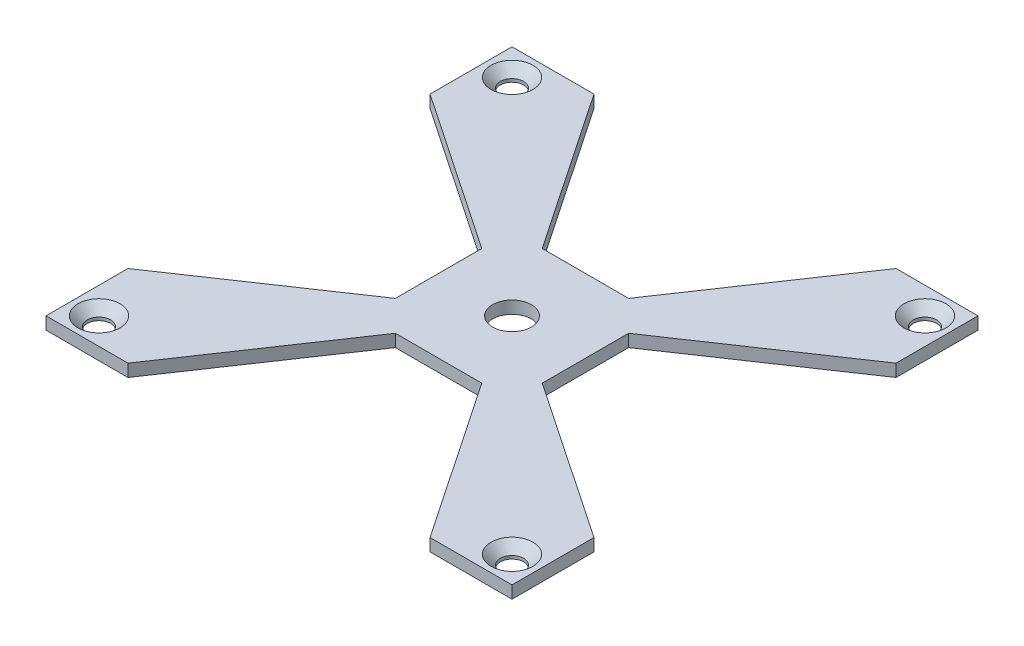
from build123d import *

# Parameters (mm, degrees)
SKETCH1_W                          = 95.25
SKETCH1_H                          = 95.25
BASE_EXTRUDE_DEPTH                 = 2.54
F_3_16_0_1875_DIAMETER_HOLE1_D     = 4.7625
F_3_16_0_1875_DIAMETER_HOLE1_DEPTH = 2.54
F_3_16_0_1875_DIAMETER_HOLE1_TIP   = 1.430799349
CUT_EXTRUDE1_REACH                 = 69.4
F_5_16_0_3125_DIAMETER_HOLE1_D     = 7.9375
CHAMFER1_SIZE                      = 1.905


with BuildPart() as part:
    # Sketch1 → Base Extrude (new body)
    with BuildSketch(Plane(origin=(0, 0, 0), x_dir=(1, 0, 0), z_dir=(0, 1, 0))):
        Rectangle(SKETCH1_W, SKETCH1_H)
    extrude(amount=BASE_EXTRUDE_DEPTH)

    # 3/16 (0.1875) Diameter Hole1
    with Locations(Plane(origin=(0, 2.54, 0), x_dir=(1, 0, 0), z_dir=(0, 1, 0))):
        with Locations((-42.207203769, 42.207203769), (42.207203769, 42.207203769), (42.207203769, -42.207203769), (-42.207203769, -42.207203769)):
            Hole(F_3_16_0_1875_DIAMETER_HOLE1_D / 2, depth=F_3_16_0_1875_DIAMETER_HOLE1_DEPTH)
            with Locations((0, 0, -(F_3_16_0_1875_DIAMETER_HOLE1_DEPTH + F_3_16_0_1875_DIAMETER_HOLE1_TIP / 2))):  # 118° drill point
                Cone(0, F_3_16_0_1875_DIAMETER_HOLE1_D / 2, F_3_16_0_1875_DIAMETER_HOLE1_TIP, mode=Mode.SUBTRACT)

    # Sketch12 → Cut-Extrude1 (cut, up to next)
    with BuildSketch(Plane(origin=(0, 2.54, 0), x_dir=(1, 0, 0), z_dir=(0, 1, 0)), mode=Mode.PRIVATE) as cut_extrude1_sk1:
        Polygon((-15.006272328, 8.830810905), (-15.006272328, -8.830810905), (-47.625, -30.869032315), (-47.625, 30.869032315), align=None)
    cut_extrude1_tool1 = extrude(cut_extrude1_sk1.sketch, amount=-CUT_EXTRUDE1_REACH, mode=Mode.PRIVATE) & part.part
    # Sketch12 → Cut-Extrude1 (cut, up to next)
    with BuildSketch(Plane(origin=(0, 2.54, 0), x_dir=(1, 0, 0), z_dir=(0, 1, 0)), mode=Mode.PRIVATE) as cut_extrude1_sk2:
        Polygon((30.869032315, 47.625), (-30.869032315, 47.625), (-8.830810905, 15.006272328), (8.830810905, 15.006272328), align=None)
    cut_extrude1_tool2 = extrude(cut_extrude1_sk2.sketch, amount=-CUT_EXTRUDE1_REACH, mode=Mode.PRIVATE) & part.part
    # Sketch12 → Cut-Extrude1 (cut, up to next)
    with BuildSketch(Plane(origin=(0, 2.54, 0), x_dir=(1, 0, 0), z_dir=(0, 1, 0)), mode=Mode.PRIVATE) as cut_extrude1_sk3:
        Polygon((47.625, -30.869032315), (47.625, 30.869032315), (15.006272328, 8.830810905), (15.006272328, -8.830810905), align=None)
    cut_extrude1_tool3 = extrude(cut_extrude1_sk3.sketch, amount=-CUT_EXTRUDE1_REACH, mode=Mode.PRIVATE) & part.part
    # Sketch12 → Cut-Extrude1 (cut, up to next)
    with BuildSketch(Plane(origin=(0, 2.54, 0), x_dir=(1, 0, 0), z_dir=(0, 1, 0)), mode=Mode.PRIVATE) as cut_extrude1_sk4:
        Polygon((-30.869032315, -47.625), (30.869032315, -47.625), (8.830810905, -15.006272328), (-8.830810905, -15.006272328), align=None)
    cut_extrude1_tool4 = extrude(cut_extrude1_sk4.sketch, amount=-CUT_EXTRUDE1_REACH, mode=Mode.PRIVATE) & part.part
    add(cut_extrude1_tool1.solids().sort_by_distance((-34.333527, 2.54, 0))[0], mode=Mode.SUBTRACT)
    add(cut_extrude1_tool2.solids().sort_by_distance((0, 2.54, -34.333527))[0], mode=Mode.SUBTRACT)
    add(cut_extrude1_tool3.solids().sort_by_distance((34.333527, 2.54, 0))[0], mode=Mode.SUBTRACT)
    add(cut_extrude1_tool4.solids().sort_by_distance((0, 2.54, 34.333527))[0], mode=Mode.SUBTRACT)

    # 5/16 (0.3125) Diameter Hole1 (through all)
    with Locations(Plane(origin=(0, 2.54, 0), x_dir=(1, 0, 0), z_dir=(0, 1, 0))):
        with Locations((0, 0)):
            Hole(F_5_16_0_3125_DIAMETER_HOLE1_D / 2)

    # Chamfer1
    chamfer1_edges = [part.edges().sort_by_distance(p)[0] for p in [
        (-39.825953769, 2.54, 42.207203769),
        (44.588453769, 2.54, 42.207203769),
        (44.588453769, 2.54, -42.207203769),
        (-39.825953769, 2.54, -42.207203769),
    ]]
    chamfer(chamfer1_edges, length=CHAMFER1_SIZE)


solid = part.part
